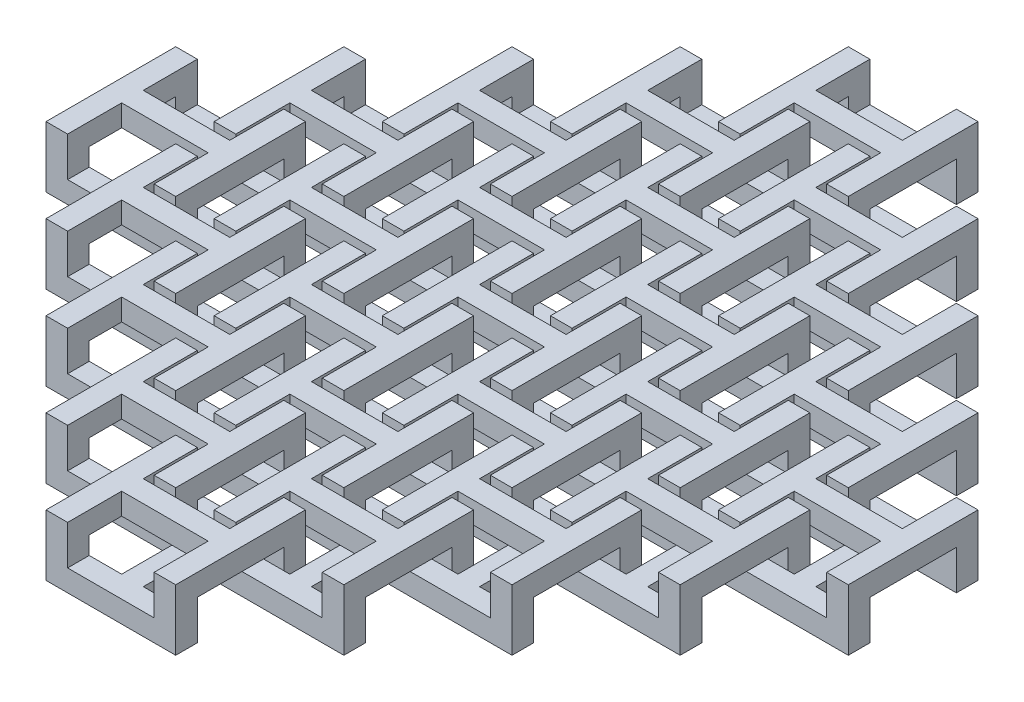
from build123d import *

# Parameters (mm, degrees)
BOSS_EXTRUDE1_DEPTH = 2
SKETCH3_W           = 2
SKETCH3_H           = 2
BOSS_EXTRUDE3_DEPTH = 1.65
BOSS_EXTRUDE4_DEPTH = 2
LPATTERN1_COUNT     = 5
LPATTERN1_PITCH     = 11
LPATTERN2_COUNT     = 5
LPATTERN2_PITCH     = 11


with BuildPart() as part:
    # Sketch1 → Boss-Extrude1 (new body)
    with BuildSketch(Plane(origin=(0, 0, 0), x_dir=(1, 0, 0), z_dir=(0, 1, 0))):
        Polygon((2, 8), (7, 8), (7, 10), (-5, 10), (-5, 8), (0, 8), (0, 0), (-5, 0), (-5, -2), (7, -2), (7, 0), (2, 0), align=None)
    extrude(amount=BOSS_EXTRUDE1_DEPTH)

    # Sketch3 → Boss-Extrude3 (add)
    with BuildSketch(Plane(origin=(0, 2, 0), x_dir=(1, 0, 0), z_dir=(0, 1, 0))):
        with Locations((-4, 9)):
            Rectangle(SKETCH3_W, SKETCH3_H)
        with Locations((6, 9)):
            Rectangle(SKETCH3_W, SKETCH3_H)
        with Locations((6, -1)):
            Rectangle(SKETCH3_W, SKETCH3_H)
        with Locations((-4, -1)):
            Rectangle(SKETCH3_W, SKETCH3_H)
    extrude(amount=BOSS_EXTRUDE3_DEPTH)

    # Sketch2 → Boss-Extrude4 (add)
    with BuildSketch(Plane(origin=(0, 3.65, 0), x_dir=(1, 0, 0), z_dir=(0, 1, 0))):
        Polygon((7, 10), (5, 10), (5, 5), (-3, 5), (-3, 10), (-5, 10), (-5, -2), (-3, -2), (-3, 3), (5, 3), (5, -2), (7, -2), align=None)
    extrude(amount=BOSS_EXTRUDE4_DEPTH)


with BuildPart() as lpattern1_1:
    # LPattern1: pattern copy
    add(part.part.moved(Location(Vector(0.7071067811865476, 0, 0.7071067811865475) * (1 * LPATTERN1_PITCH))))


with BuildPart() as lpattern1_2:
    # LPattern1: pattern copy
    add(part.part.moved(Location(Vector(0.7071067811865476, 0, 0.7071067811865475) * (2 * LPATTERN1_PITCH))))


with BuildPart() as lpattern1_3:
    # LPattern1: pattern copy
    add(part.part.moved(Location(Vector(0.7071067811865476, 0, 0.7071067811865475) * (3 * LPATTERN1_PITCH))))


with BuildPart() as lpattern1_4:
    # LPattern1: pattern copy
    add(part.part.moved(Location(Vector(0.7071067811865476, 0, 0.7071067811865475) * (4 * LPATTERN1_PITCH))))


with BuildPart() as lpattern2_1:
    # LPattern2: pattern copy
    add(part.part.moved(Location(Vector(0.7071067811865476, 0, -0.7071067811865476) * (1 * LPATTERN2_PITCH))))


with BuildPart() as lpattern2_2:
    # LPattern2: pattern copy
    add(part.part.moved(Location(Vector(0.7071067811865476, 0, -0.7071067811865476) * (2 * LPATTERN2_PITCH))))


with BuildPart() as lpattern2_3:
    # LPattern2: pattern copy
    add(part.part.moved(Location(Vector(0.7071067811865476, 0, -0.7071067811865476) * (3 * LPATTERN2_PITCH))))


with BuildPart() as lpattern2_4:
    # LPattern2: pattern copy
    add(part.part.moved(Location(Vector(0.7071067811865476, 0, -0.7071067811865476) * (4 * LPATTERN2_PITCH))))


with BuildPart() as lpattern2_5:
    # LPattern2: pattern copy
    add(lpattern1_1.part.moved(Location(Vector(0.7071067811865476, 0, -0.7071067811865476) * (1 * LPATTERN2_PITCH))))


with BuildPart() as lpattern2_6:
    # LPattern2: pattern copy
    add(lpattern1_1.part.moved(Location(Vector(0.7071067811865476, 0, -0.7071067811865476) * (2 * LPATTERN2_PITCH))))


with BuildPart() as lpattern2_7:
    # LPattern2: pattern copy
    add(lpattern1_1.part.moved(Location(Vector(0.7071067811865476, 0, -0.7071067811865476) * (3 * LPATTERN2_PITCH))))


with BuildPart() as lpattern2_8:
    # LPattern2: pattern copy
    add(lpattern1_1.part.moved(Location(Vector(0.7071067811865476, 0, -0.7071067811865476) * (4 * LPATTERN2_PITCH))))


with BuildPart() as lpattern2_9:
    # LPattern2: pattern copy
    add(lpattern1_2.part.moved(Location(Vector(0.7071067811865476, 0, -0.7071067811865476) * (1 * LPATTERN2_PITCH))))


with BuildPart() as lpattern2_10:
    # LPattern2: pattern copy
    add(lpattern1_2.part.moved(Location(Vector(0.7071067811865476, 0, -0.7071067811865476) * (2 * LPATTERN2_PITCH))))


with BuildPart() as lpattern2_11:
    # LPattern2: pattern copy
    add(lpattern1_2.part.moved(Location(Vector(0.7071067811865476, 0, -0.7071067811865476) * (3 * LPATTERN2_PITCH))))


with BuildPart() as lpattern2_12:
    # LPattern2: pattern copy
    add(lpattern1_2.part.moved(Location(Vector(0.7071067811865476, 0, -0.7071067811865476) * (4 * LPATTERN2_PITCH))))


with BuildPart() as lpattern2_13:
    # LPattern2: pattern copy
    add(lpattern1_3.part.moved(Location(Vector(0.7071067811865476, 0, -0.7071067811865476) * (1 * LPATTERN2_PITCH))))


with BuildPart() as lpattern2_14:
    # LPattern2: pattern copy
    add(lpattern1_3.part.moved(Location(Vector(0.7071067811865476, 0, -0.7071067811865476) * (2 * LPATTERN2_PITCH))))


with BuildPart() as lpattern2_15:
    # LPattern2: pattern copy
    add(lpattern1_3.part.moved(Location(Vector(0.7071067811865476, 0, -0.7071067811865476) * (3 * LPATTERN2_PITCH))))


with BuildPart() as lpattern2_16:
    # LPattern2: pattern copy
    add(lpattern1_3.part.moved(Location(Vector(0.7071067811865476, 0, -0.7071067811865476) * (4 * LPATTERN2_PITCH))))


with BuildPart() as lpattern2_17:
    # LPattern2: pattern copy
    add(lpattern1_4.part.moved(Location(Vector(0.7071067811865476, 0, -0.7071067811865476) * (1 * LPATTERN2_PITCH))))


with BuildPart() as lpattern2_18:
    # LPattern2: pattern copy
    add(lpattern1_4.part.moved(Location(Vector(0.7071067811865476, 0, -0.7071067811865476) * (2 * LPATTERN2_PITCH))))


with BuildPart() as lpattern2_19:
    # LPattern2: pattern copy
    add(lpattern1_4.part.moved(Location(Vector(0.7071067811865476, 0, -0.7071067811865476) * (3 * LPATTERN2_PITCH))))


with BuildPart() as lpattern2_20:
    # LPattern2: pattern copy
    add(lpattern1_4.part.moved(Location(Vector(0.7071067811865476, 0, -0.7071067811865476) * (4 * LPATTERN2_PITCH))))


solid = Compound([part.part, lpattern1_1.part, lpattern1_2.part, lpattern1_3.part, lpattern1_4.part, lpattern2_1.part, lpattern2_2.part, lpattern2_3.part, lpattern2_4.part, lpattern2_5.part, lpattern2_6.part, lpattern2_7.part, lpattern2_8.part, lpattern2_9.part, lpattern2_10.part, lpattern2_11.part, lpattern2_12.part, lpattern2_13.part, lpattern2_14.part, lpattern2_15.part, lpattern2_16.part, lpattern2_17.part, lpattern2_18.part, lpattern2_19.part, lpattern2_20.part])
